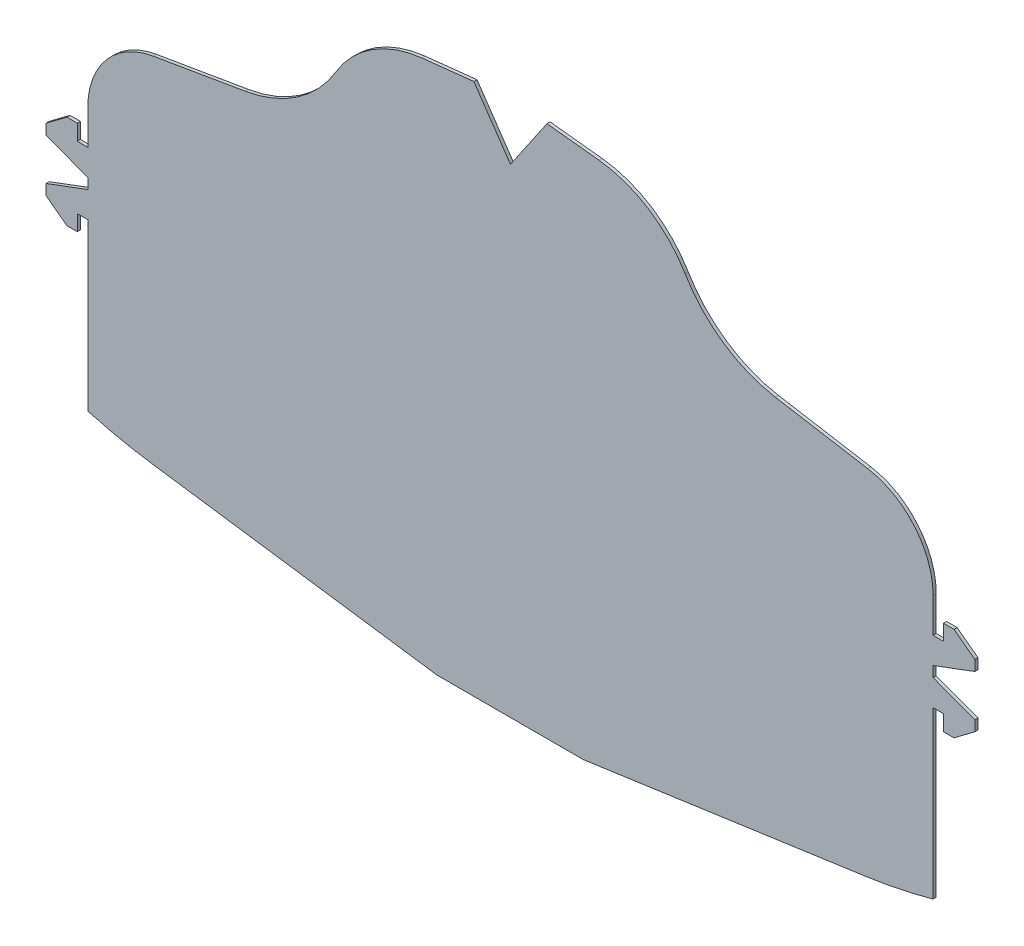
from build123d import *

# Parameters (mm, degrees)
MAIN_SHAPE_DEPTH = 0.6
FILLET1_R        = 15


with BuildPart() as part:
    # Sketch2 → Main Shape (new body)
    with BuildSketch(Plane.XY):
        with BuildLine():
            Line((-14, -91.764766734), (14, -91.764766734))
            Line((14, -91.764766734), (68.266232563, -84.05670244))
            ThreePointArc((68.266232563, -84.05670244), (74.651075824, -82.937586842), (80.95, -81.407162906))
            Line((80.95, -81.407162906), (80.95, -49.66))
            Line((80.95, -49.66), (82.95, -49.66))
            Line((82.95, -49.66), (82.95, -52.66))
            Line((82.95, -52.66), (84.95, -52.66))
            Line((84.95, -52.66), (88.95, -49.66))
            Line((88.95, -49.66), (88.95, -47.66))
            Line((88.95, -47.66), (80.95, -44.66))
            Line((80.95, -44.66), (80.95, -42.66))
            Line((80.95, -42.66), (88.95, -39.66))
            Line((88.95, -39.66), (88.95, -37.66))
            Line((88.95, -37.66), (84.95, -34.66))
            Line((84.95, -34.66), (82.95, -34.66))
            Line((82.95, -34.66), (82.95, -37.66))
            Line((82.95, -37.66), (80.95, -37.66))
            Line((80.95, -37.66), (80.95, -18.389599053))
            Line((80.95, -18.389599053), (50.74391922, -13.264766734))
            ThreePointArc((50.74391922, -13.264766734), (40.804108255, -9.246591688), (33.461443341, -1.434367632))
            ThreePointArc((33.461443341, -1.434367632), (26.448172688, 5.805997675), (16.941855461, 9.15842781))
            Line((16.941855461, 9.15842781), (7, 10.235233266))
            Line((7, 10.235233266), (0, 0))
            Line((0, 0), (-7, 10.235233266))
            Line((-7, 10.235233266), (-16.941855461, 9.15842781))
            ThreePointArc((-16.941855461, 9.15842781), (-26.448172688, 5.805997675), (-33.461443341, -1.434367632))
            ThreePointArc((-33.461443341, -1.434367632), (-40.804108255, -9.246591688), (-50.74391922, -13.264766734))
            Line((-50.74391922, -13.264766734), (-80.95, -18.389599053))
            Line((-80.95, -18.389599053), (-80.95, -37.66))
            Line((-80.95, -37.66), (-82.95, -37.66))
            Line((-82.95, -37.66), (-82.95, -34.66))
            Line((-82.95, -34.66), (-84.95, -34.66))
            Line((-84.95, -34.66), (-88.95, -37.66))
            Line((-88.95, -37.66), (-88.95, -39.66))
            Line((-88.95, -39.66), (-80.95, -42.66))
            Line((-80.95, -42.66), (-80.95, -44.66))
            Line((-80.95, -44.66), (-88.95, -47.66))
            Line((-88.95, -47.66), (-88.95, -49.66))
            Line((-88.95, -49.66), (-84.95, -52.66))
            Line((-84.95, -52.66), (-82.95, -52.66))
            Line((-82.95, -52.66), (-82.95, -49.66))
            Line((-82.95, -49.66), (-80.95, -49.66))
            Line((-80.95, -49.66), (-80.95, -81.407162906))
            ThreePointArc((-80.95, -81.407162906), (-74.651075824, -82.937586842), (-68.266232563, -84.05670244))
            Line((-68.266232563, -84.05670244), (-14, -91.764766734))
        make_face()
    extrude(amount=MAIN_SHAPE_DEPTH)

    # Fillet1
    fillet1_edges = [part.edges().sort_by_distance(p)[0] for p in [
        (80.95, -18.389599053, 0.3),
        (-80.95, -18.389599053, 0.3),
    ]]
    fillet(fillet1_edges, radius=FILLET1_R)


solid = part.part
